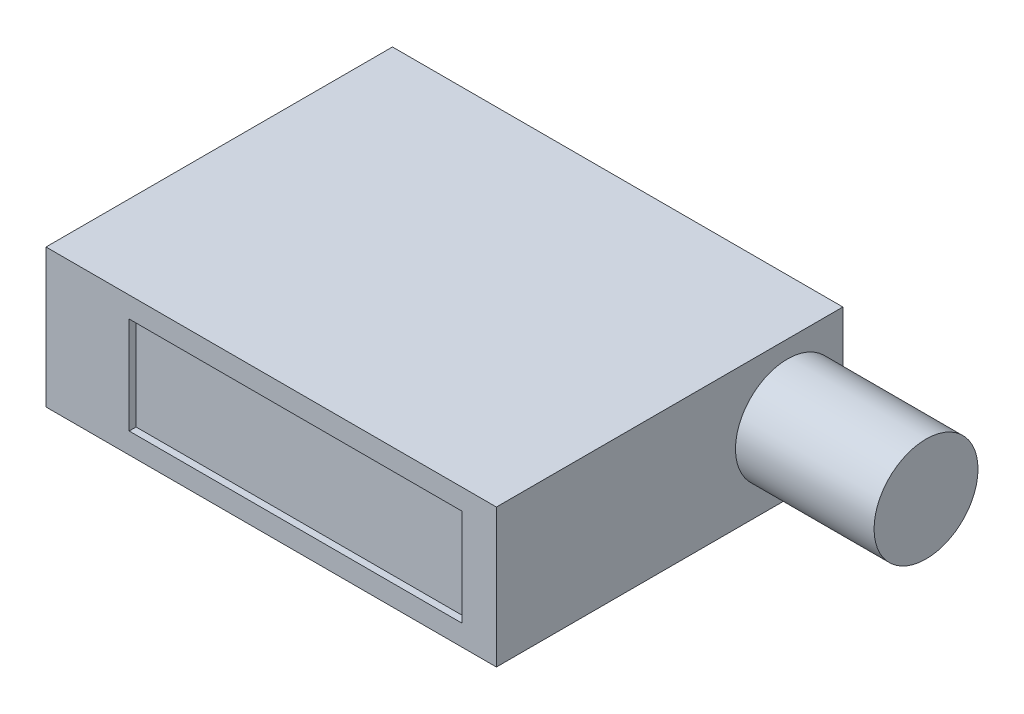
from build123d import *

# Parameters (mm, degrees)
SKETCH2_W           = 65
SKETCH2_H           = 50
BOSS_EXTRUDE1_DEPTH = 20
SKETCH4_W           = 48
SKETCH4_H           = 14
CUT_EXTRUDE1_DEPTH  = 1
SKETCH5_R           = 7.5
BOSS_EXTRUDE2_DEPTH = 20


with BuildPart() as part:
    # Sketch2 → Boss-Extrude1 (new body)
    with BuildSketch(Plane(origin=(0, 0, 0), x_dir=(1, 0, 0), z_dir=(0, 1, 0))):
        Rectangle(SKETCH2_W, SKETCH2_H)
    extrude(amount=BOSS_EXTRUDE1_DEPTH)

    # Sketch4 → Cut-Extrude1 (cut)
    with BuildSketch(Plane.XY.offset(25)):
        with Locations((3.5, 10)):
            Rectangle(SKETCH4_W, SKETCH4_H)
    extrude(amount=-CUT_EXTRUDE1_DEPTH, mode=Mode.SUBTRACT)

    # Sketch5 → Boss-Extrude2 (add)
    with BuildSketch(Plane(origin=(32.5, 0, 0), x_dir=(0, 0, -1), z_dir=(1, 0, 0))):
        with Locations(Location((17, 10, 0), (0, 0, 180))):
            Circle(SKETCH5_R)
    extrude(amount=BOSS_EXTRUDE2_DEPTH)


solid = part.part
